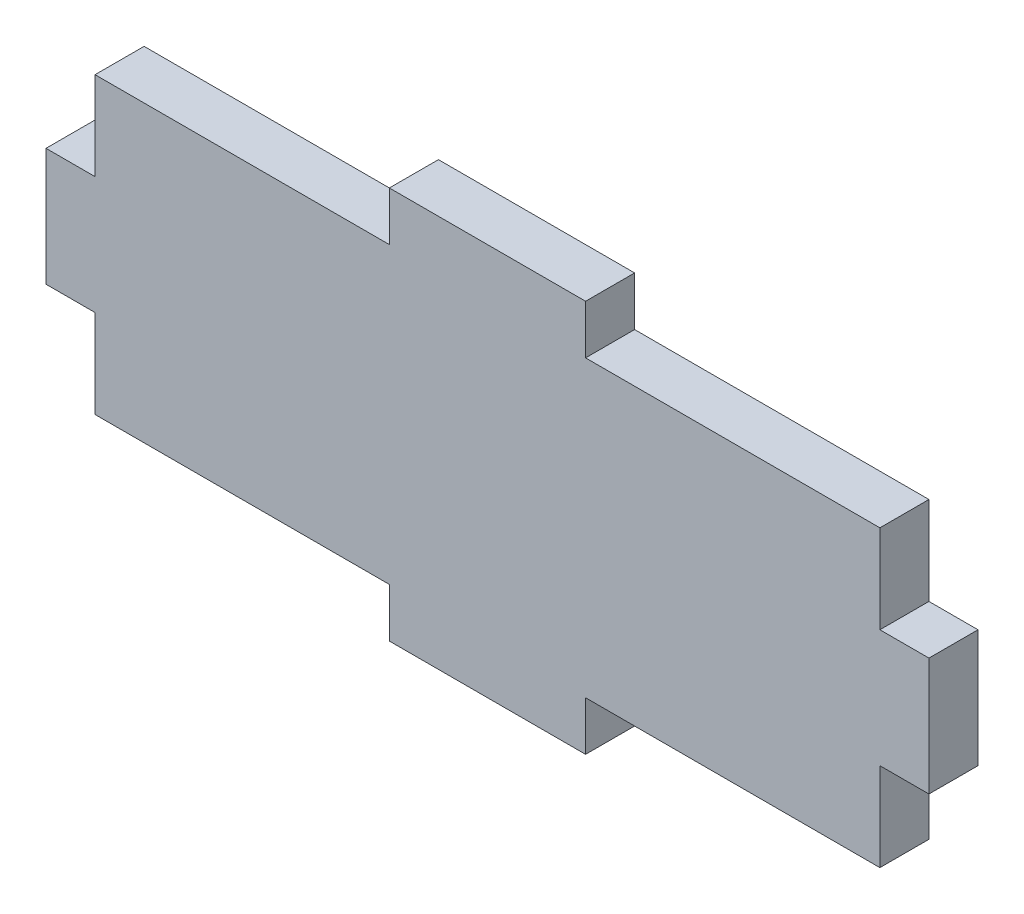
from build123d import *

# Parameters (mm, degrees)
BOSS_EXTRUDE1_DEPTH = 5


with BuildPart() as part:
    # Sketch1 → Boss-Extrude1 (new body)
    with BuildSketch(Plane.XY):
        Polygon((-45, -6), (-45, 6), (-40, 6), (-40, 15), (-10, 15), (-10, 20), (10, 20), (10, 15), (40, 15), (40, 6), (45, 6), (45, -6), (40, -6), (40, -15), (10, -15), (10, -20), (-10, -20), (-10, -15), (-40, -15), (-40, -6), align=None)
    extrude(amount=BOSS_EXTRUDE1_DEPTH)


solid = part.part
